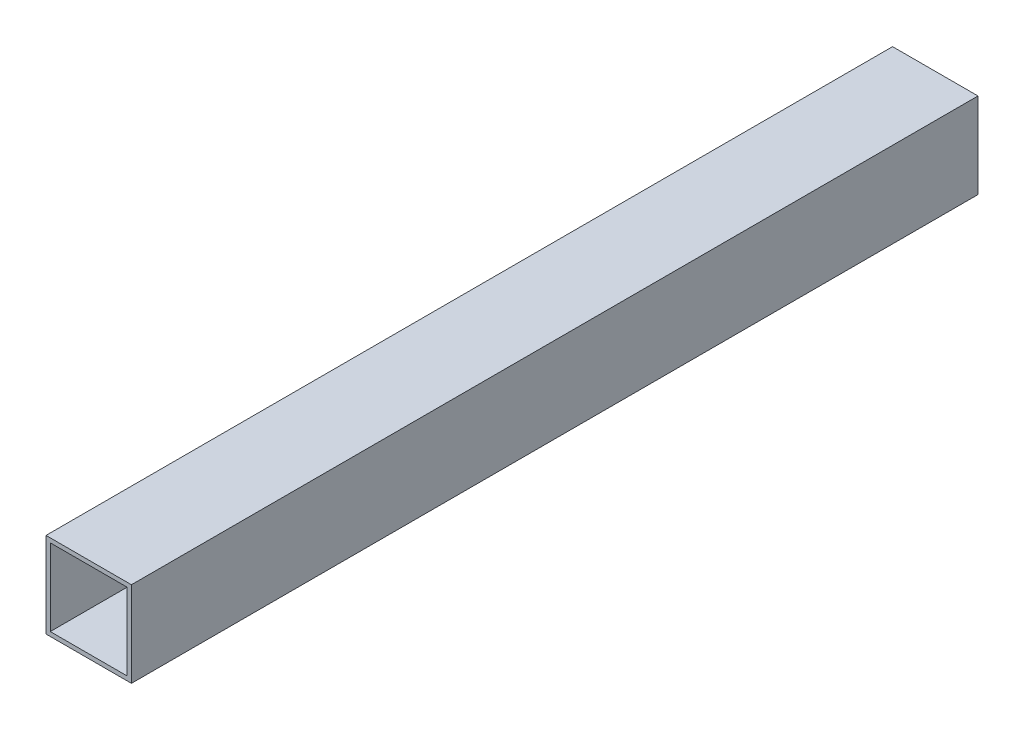
from build123d import *

# Parameters (mm, degrees)
SKETCH1_W           = 20
SKETCH1_H           = 20
SKETCH1_W_2         = 18
SKETCH1_H_2         = 18
BOSS_EXTRUDE1_DEPTH = 198.2


with BuildPart() as part:
    # Sketch1 → Boss-Extrude1 (new body)
    with BuildSketch(Plane.XY):
        Rectangle(SKETCH1_W, SKETCH1_H)
        Rectangle(SKETCH1_W_2, SKETCH1_H_2, mode=Mode.SUBTRACT)
    extrude(amount=BOSS_EXTRUDE1_DEPTH)


solid = part.part
